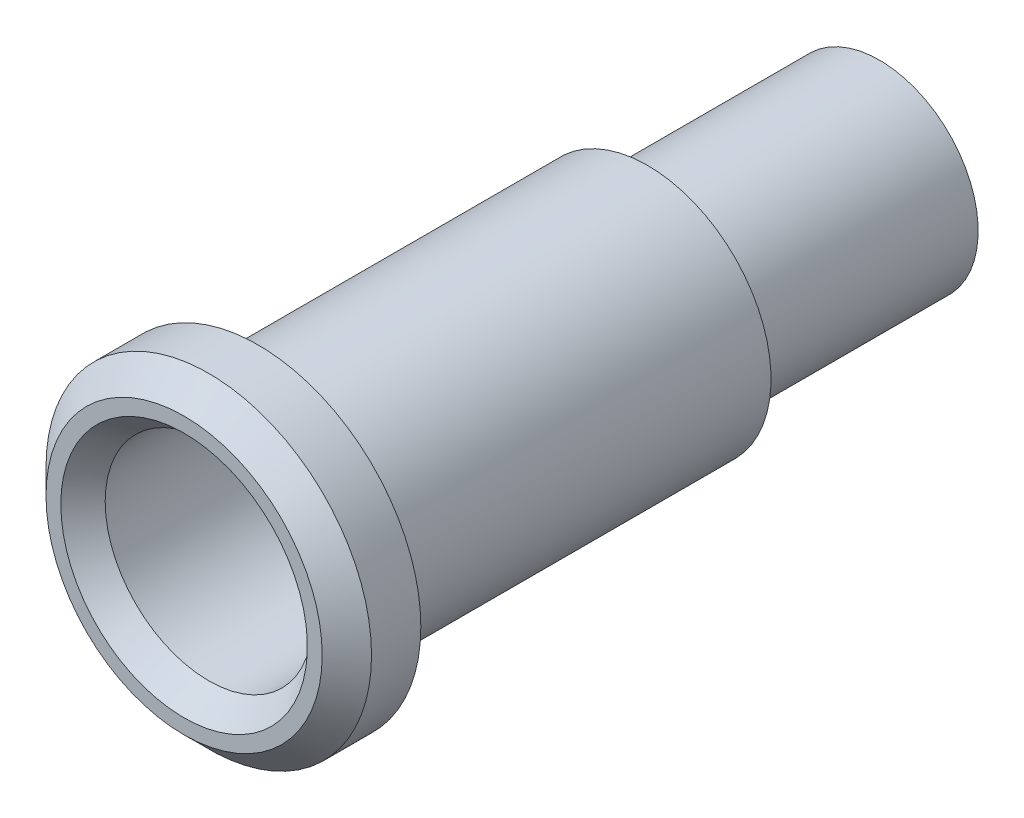
from build123d import *


with BuildPart() as part:
    # Sketch1 → Revolve1 (revolve)
    with BuildSketch(Plane.XZ, mode=Mode.PRIVATE) as revolve1_sk:
        Polygon((2.1, -6.9), (1.425, -6.9), (1.425, -7.9), (1, -7.9), (1, -12.6), (2, -12.6), (2, -7.9), (2.5, -7.9), (2.5, 0), (3.3, 0), (3.3, 1), (2.8, 1.5), (2.5, 1.5), (2.1, 1), align=None)
    revolve(revolve1_sk.sketch.rotate(Axis((0, 0, 1.5), (0, 0, -1)), 180), axis=Axis((0, 0, 1.5), (0, 0, -1)))


solid = part.part
